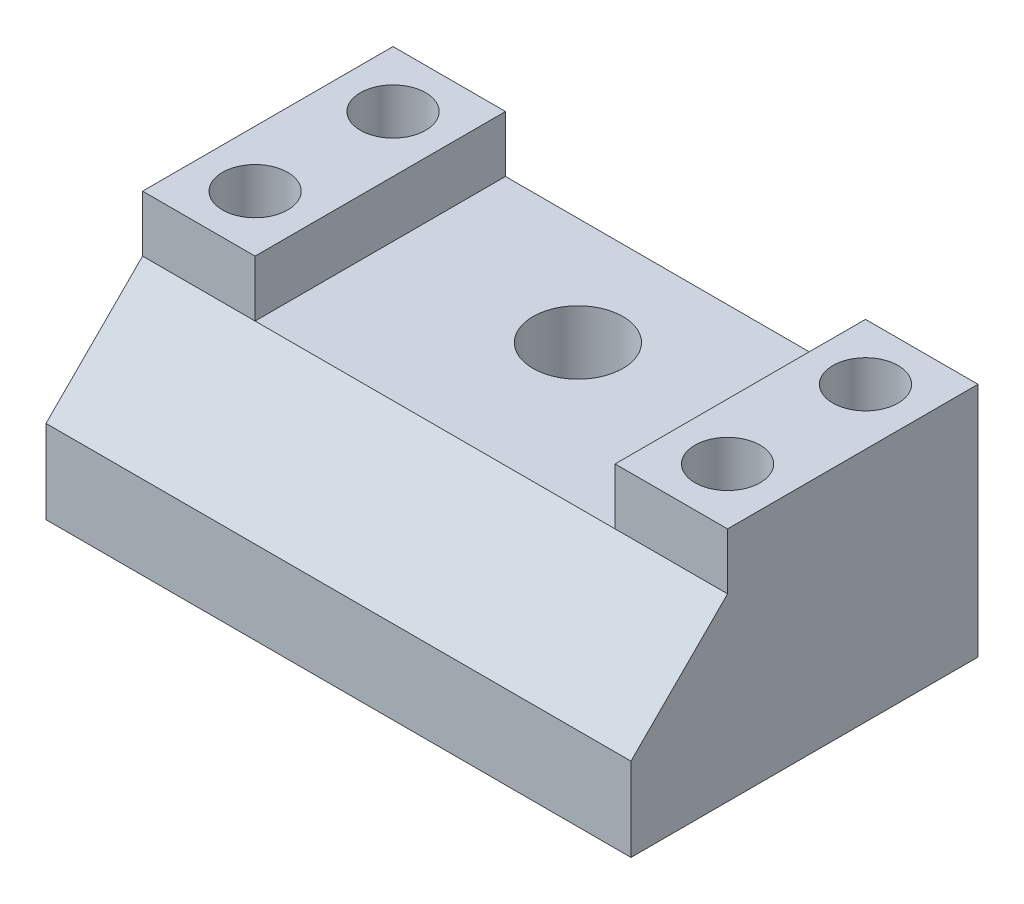
from build123d import *

# Parameters (mm, degrees)
SKETCH1_W            = 32
SKETCH1_H            = 23.261633661
SKETCH1_R            = 4
BOSS_EXTRUDE1_DEPTH  = 10
SKETCH3_W            = 10
SKETCH3_H            = 23.261633661
BOSS_EXTRUDE2_DEPTH  = 15
BOSS_EXTRUDE3_DEPTH  = 15
CUT_EXTRUDE1_DEPTH   = 61.230307985
M5_CLEARANCE_HOLE1_D = 5.8
CHAMFER1_SIZE        = 2
CHAMFER1_SIZE2       = 1.414213562
BOSS_EXTRUDE4_START  = 6
SKETCH9_W            = 52
SKETCH9_H            = 30.847420099
SKETCH9_R            = 2.9
SKETCH9_R_2          = 4
BOSS_EXTRUDE4_DEPTH  = 6


with BuildPart() as part:
    # Sketch1 → Boss-Extrude1 (new body)
    with BuildSketch(Plane(origin=(0, 0, 0), x_dir=(1, 0, 0), z_dir=(0, 1, 0))):
        with Locations((0, -2.06918317)):
            Rectangle(SKETCH1_W, SKETCH1_H)
        with Locations(Location((0, 0, 0), (0, 0, 270))):
            Circle(SKETCH1_R, mode=Mode.SUBTRACT)
    extrude(amount=-BOSS_EXTRUDE1_DEPTH)

    # Sketch3 → Boss-Extrude2 (add)
    with BuildSketch(Plane.XZ.offset(10)):
        with Locations((-21, 2.06918317)):
            Rectangle(SKETCH3_W, SKETCH3_H)
        with Locations((21, 2.06918317)):
            Rectangle(SKETCH3_W, SKETCH3_H)
    extrude(amount=-BOSS_EXTRUDE2_DEPTH)

    # Sketch5 → Boss-Extrude3 (add)
    with BuildSketch(Plane.XY.offset(13.7)):
        Polygon((16, 0), (-16, 0), (-16, 5), (-26, 5), (-26, -10), (26, -10), (26, 5), (16, 5), align=None)
    extrude(amount=BOSS_EXTRUDE3_DEPTH)

    # Sketch6 → Cut-Extrude1 (cut, through all)
    with BuildSketch(Plane.ZY.offset(26)):
        Polygon((12.7, 0), (22.7, -10), (28.7, -10), (28.7, 5), (12.7, 5), align=None)
    extrude(amount=-CUT_EXTRUDE1_DEPTH, mode=Mode.SUBTRACT)

    # M5 Clearance Hole1 (through all)
    with Locations(Plane(origin=(0, 5, 0), x_dir=(1, 0, 0), z_dir=(0, 1, 0))):
        with Locations((21, 4.561633661), (-21, 4.561633661), (-21, -7.7), (21, -7.7)):
            Hole(M5_CLEARANCE_HOLE1_D / 2)

    # Chamfer1
    chamfer1_edges = [part.edges().sort_by_distance(p)[0] for p in [
        (0, -10, 22.7),
    ]]
    chamfer1_side = [part.faces().sort_by_distance(p)[0] for p in [
        (0, -5, 17.7),
    ]]
    chamfer(chamfer1_edges, length=CHAMFER1_SIZE, length2=CHAMFER1_SIZE2, reference=chamfer1_side[0])

    # Sketch9 → Boss-Extrude4 (add)
    with BuildSketch(Plane.XZ.offset(10).offset(BOSS_EXTRUDE4_START)):
        with Locations((0, 5.862076389)):
            Rectangle(SKETCH9_W, SKETCH9_H)
        with Locations(Location((21, -4.561633661, 0), (0, 0, 90))):
            Circle(SKETCH9_R, mode=Mode.SUBTRACT)
        with Locations(Location((21, 7.7, 0), (0, 0, 90))):
            Circle(SKETCH9_R, mode=Mode.SUBTRACT)
        with Locations(Location((0, 0, 0), (0, 0, 90))):
            Circle(SKETCH9_R_2, mode=Mode.SUBTRACT)
        with Locations(Location((-21, -4.561633661, 0), (0, 0, 90))):
            Circle(SKETCH9_R, mode=Mode.SUBTRACT)
        with Locations(Location((-21, 7.7, 0), (0, 0, 90))):
            Circle(SKETCH9_R, mode=Mode.SUBTRACT)
    extrude(amount=-BOSS_EXTRUDE4_DEPTH)


solid = part.part
